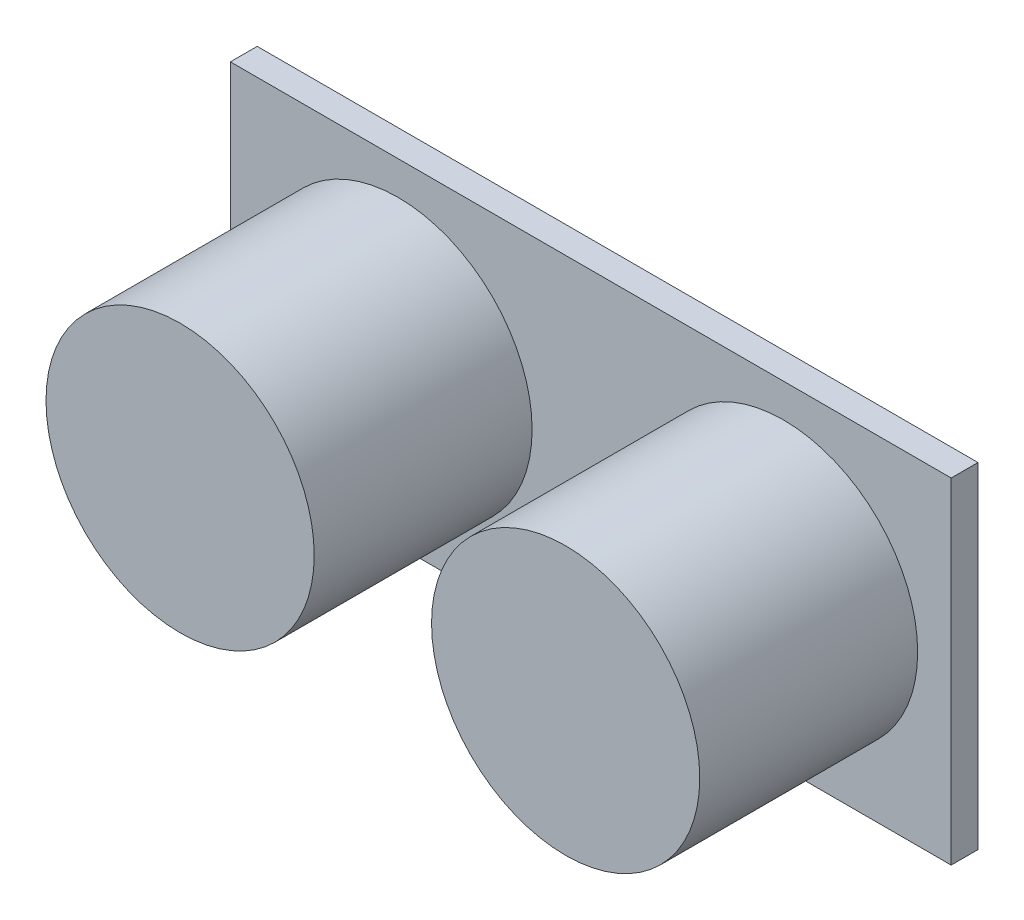
from build123d import *

# Parameters (mm, degrees)
SKETCH1_W           = 43
SKETCH1_H           = 20
BOSS_EXTRUDE1_DEPTH = 1.6
SKETCH2_R           = 8
BOSS_EXTRUDE2_DEPTH = 13


with BuildPart() as part:
    # Sketch1 → Boss-Extrude1 (new body)
    with BuildSketch(Plane.XY):
        Rectangle(SKETCH1_W, SKETCH1_H)
    extrude(amount=BOSS_EXTRUDE1_DEPTH)

    # Sketch2 → Boss-Extrude2 (add)
    with BuildSketch(Plane.XY.offset(1.6)):
        with Locations(Location((-11.5, 0, 0), (0, 0, 180))):
            Circle(SKETCH2_R)
        with Locations(Location((11.5, 0, 0), (0, 0, 180))):
            Circle(SKETCH2_R)
    extrude(amount=BOSS_EXTRUDE2_DEPTH)


solid = part.part
